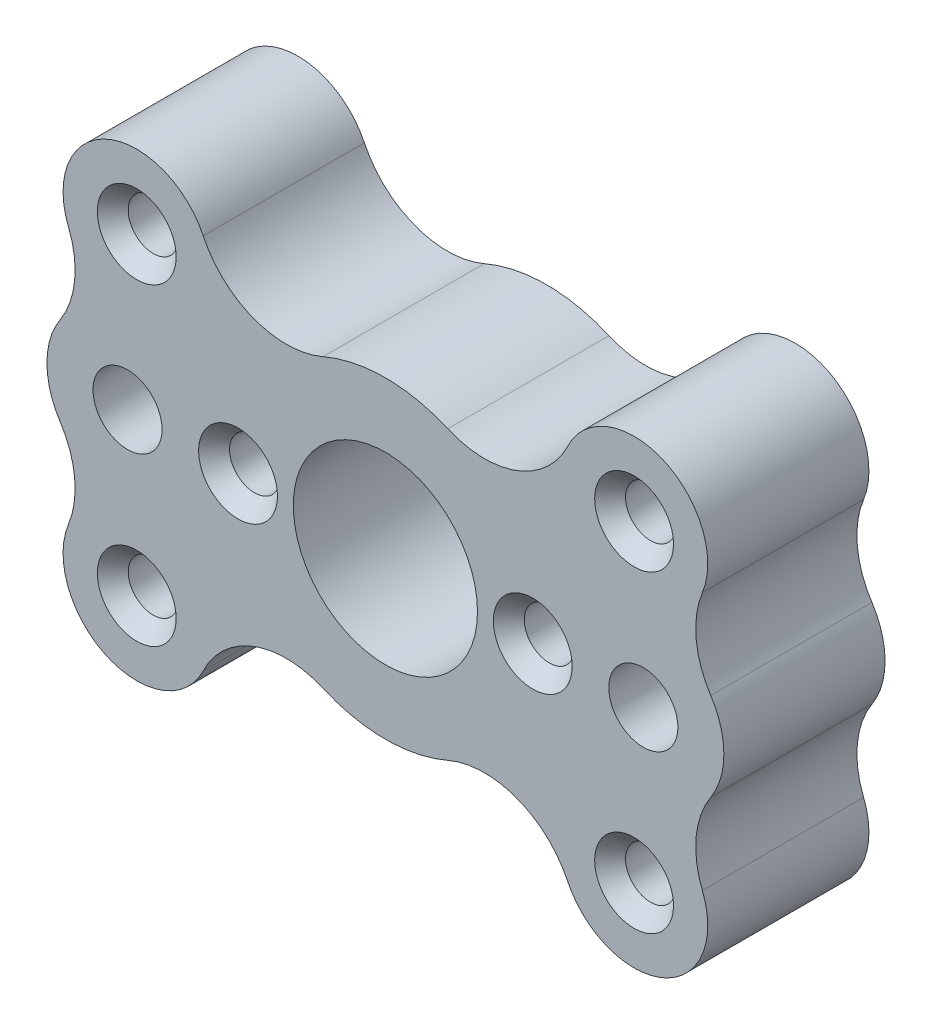
from build123d import *
from build123d.topology import SkipClean

# Parameters (mm, degrees)
SKETCH1_R                      = 2.38125
BOSS_EXTRUDE1_DEPTH            = 11.1125
F_8_32_TAPPED_HOLE1_AT_2_COUNT = 2
F_8_32_TAPPED_HOLE1_AT_2_PITCH = 12.857770024
F_8_32_TAPPED_HOLE1_AT_3_COUNT = 2
F_8_32_TAPPED_HOLE1_AT_3_PITCH = 12.857770024


with BuildPart() as part:
    # Sketch1 → Boss-Extrude1 (new body)
    with BuildSketch(Plane.XY):
        with BuildLine():
            ThreePointArc((0, -6.35), (-6.35, 0), (0, 6.35))
            Line((0, 6.35), (0, 10.795))
            ThreePointArc((0, 10.795), (-2.197021558, 10.569064352), (-4.302077301, 9.900714918))
            ThreePointArc((-4.302077301, 9.900714918), (-9.054681629, 9.776106511), (-12.561760448, 12.985962165))
            ThreePointArc((-12.561760448, 12.985962165), (-19.192123591, 15.444267147), (-21.855781895, 8.89370204))
            ThreePointArc((-21.855781895, 8.89370204), (-21.424604414, 5.897029127), (-22.429987657, 3.041303808))
            ThreePointArc((-22.429987657, 3.041303808), (-23.33625, 0), (-22.429987657, -3.041303808))
            ThreePointArc((-22.429987657, -3.041303808), (-21.424604414, -5.897029127), (-21.855781895, -8.89370204))
            ThreePointArc((-21.855781895, -8.89370204), (-19.192123591, -15.444267147), (-12.561760448, -12.985962165))
            ThreePointArc((-12.561760448, -12.985962165), (-9.054681629, -9.776106511), (-4.302077301, -9.900714918))
            ThreePointArc((-4.302077301, -9.900714918), (-2.197021558, -10.569064352), (0, -10.795))
            Line((0, -10.795), (0, -6.35))
        make_face()
        with Locations((-17.78, 0)):
            Circle(SKETCH1_R, mode=Mode.SUBTRACT)
    extrude(amount=BOSS_EXTRUDE1_DEPTH)

    # Sketch2 → #8-32 Tapped Hole1 (revolve, cut)
    with BuildSketch(Plane(origin=(-10.16, 0, 11.1125), x_dir=(0, -1, 0), z_dir=(1, 0, 0))):
        Polygon((0, 0), (0, 11.1125), (2.72923, 11.1125), (1.7272, 9.959796345), (1.7272, 1.139554944), (2.7178, 0), align=None)
    f_8_32_tapped_hole1 = revolve(axis=Axis((-10.16, 0, 17.4625), (0, 0, -1)), mode=Mode.SUBTRACT)

    # #8-32 Tapped Hole1 at 2: #8-32 Tapped Hole1 ×2
    with Locations(*[Vector(-0.5432512781572743, 0.8395701571521511, 0) * (i * F_8_32_TAPPED_HOLE1_AT_2_PITCH) for i in range(1, F_8_32_TAPPED_HOLE1_AT_2_COUNT)]):
        add(f_8_32_tapped_hole1, mode=Mode.SUBTRACT)

    # #8-32 Tapped Hole1 at 3: #8-32 Tapped Hole1 ×2
    with Locations(*[Vector(-0.5432512781572741, -0.8395701571521512, 0) * (i * F_8_32_TAPPED_HOLE1_AT_3_PITCH) for i in range(1, F_8_32_TAPPED_HOLE1_AT_3_COUNT)]):
        add(f_8_32_tapped_hole1, mode=Mode.SUBTRACT)

    # Mirror2: part across plane


with BuildPart() as part_1:
    with SkipClean():  # the faces are left unmerged after this step: merging them gives an invalid solid
        add(part.part)
        add(part.part.mirror(Plane(origin=(0, 6.35, 11.1125), x_dir=(0, 0, 1), z_dir=(-1, 0, 0))))


solid = part_1.part
